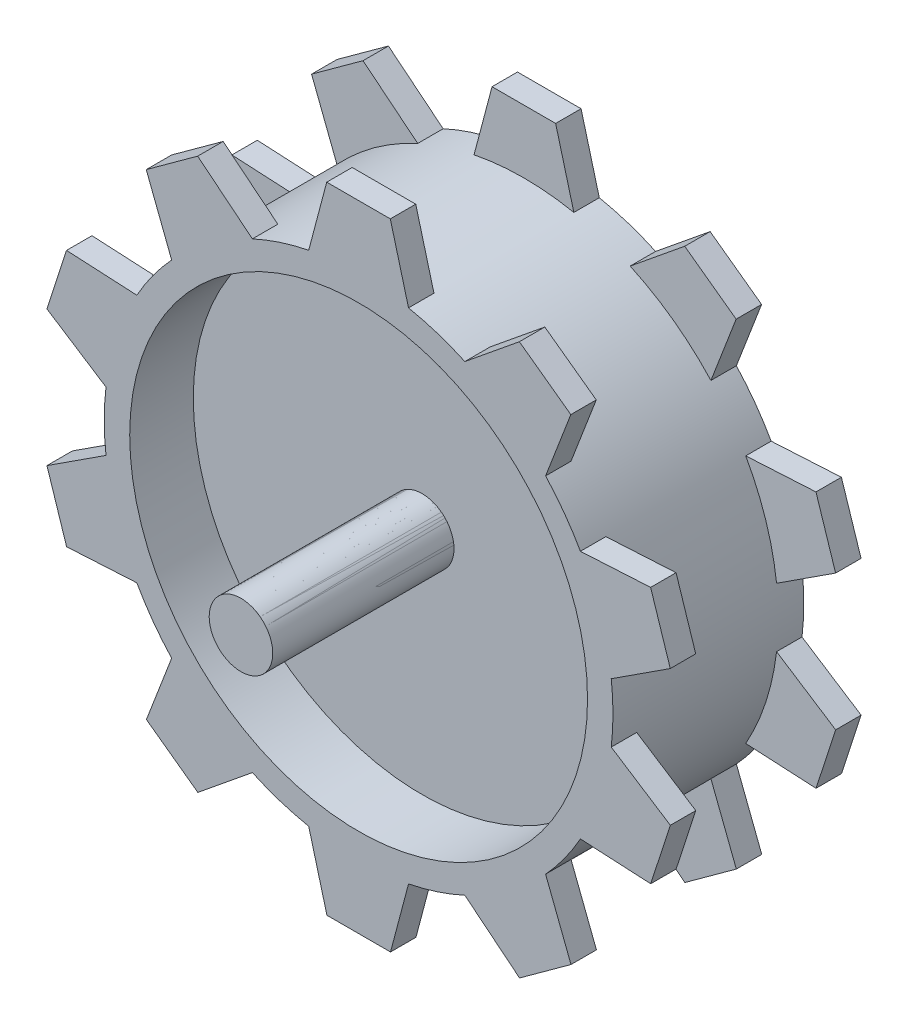
from build123d import *

# Parameters (mm, degrees)
SKETCH2_R                = 200
BOSS_EXTRUDE1_DEPTH      = 150
BOSS_EXTRUDE2_START      = -20
BOSS_EXTRUDE2_DEPTH      = 20
CIRPATTERN1_COUNT        = 10
MIRROR1_START            = -20
MIRROR1_COPY_1_DEPTH     = 20
MIRROR1_COPY_2_DEPTH     = 20
MIRROR1_COPY_3_DEPTH     = 20
MIRROR1_COPY_4_DEPTH     = 20
MIRROR1_COPY_5_DEPTH     = 20
MIRROR1_COPY_6_DEPTH     = 20
MIRROR1_COPY_7_DEPTH     = 20
MIRROR1_COPY_8_DEPTH     = 20
MIRROR1_COPY_9_DEPTH     = 20
MIRROR1_COPY_10_DEPTH    = 20
SKETCH4_R                = 25
CUT_EXTRUDE1_DEPTH       = 381.615674099
SKETCH6_R                = 180
CUT_EXTRUDE2_DEPTH       = 50
BOSS_EXTRUDE4_DEPTH      = 1
BOSS_EXTRUDE4_DEPTH_BACK = 192.5
SKETCH7_2_R              = 25
SKETCH7_R                = 25
BOSS_EXTRUDE3_DEPTH      = 192.5


with BuildPart() as part:
    # Sketch2 → Boss-Extrude1 (new body)
    with BuildSketch(Plane.XY):
        Circle(SKETCH2_R)
    extrude(amount=BOSS_EXTRUDE1_DEPTH)

    # Sketch3 → Boss-Extrude2 (add)
    with BuildSketch(Plane.XY.offset(150).offset(BOSS_EXTRUDE2_START)):
        with BuildLine():
            Line((-25.084847023, 249.575960236), (24.915152977, 249.575960236))
            Line((24.915152977, 249.575960236), (39.240601235, 196.112659496))
            ThreePointArc((39.240601235, 196.112659496), (0, 200), (-39.240601235, 196.112659496))
            Line((-39.240601235, 196.112659496), (-25.084847023, 249.575960236))
        make_face()
    boss_extrude2 = extrude(amount=BOSS_EXTRUDE2_DEPTH)

    # CirPattern1: Boss-Extrude2 ×10 about axis
    cirpattern1_axis = Axis((0, 0, 150), (0, 0, 1))
    for i in range(1, CIRPATTERN1_COUNT):
        add(boss_extrude2.rotate(cirpattern1_axis, i * 360 / CIRPATTERN1_COUNT))

    # Mirror1 copy 1 sketch → Mirror1 copy 1 (add)
    with BuildSketch(Plane(origin=(0, 0, 0), x_dir=(0.8090169943749475, 0.5877852522924731, 0), z_dir=(0, 0, -1)).offset(MIRROR1_START)):
        with BuildLine():
            Line((-25.084847023, -249.575960236), (24.915152977, -249.575960236))
            Line((24.915152977, -249.575960236), (39.240601235, -196.112659496))
            ThreePointArc((39.240601235, -196.112659496), (0, -200), (-39.240601235, -196.112659496))
            Line((-39.240601235, -196.112659496), (-25.084847023, -249.575960236))
        make_face()
    extrude(amount=MIRROR1_COPY_1_DEPTH)

    # Mirror1 copy 2 sketch → Mirror1 copy 2 (add)
    with BuildSketch(Plane(origin=(0, 0, 0), x_dir=(0.30901699437494745, 0.9510565162951535, 0), z_dir=(0, 0, -1)).offset(MIRROR1_START)):
        with BuildLine():
            Line((-25.084847023, -249.575960236), (24.915152977, -249.575960236))
            Line((24.915152977, -249.575960236), (39.240601235, -196.112659496))
            ThreePointArc((39.240601235, -196.112659496), (0, -200), (-39.240601235, -196.112659496))
            Line((-39.240601235, -196.112659496), (-25.084847023, -249.575960236))
        make_face()
    extrude(amount=MIRROR1_COPY_2_DEPTH)

    # Mirror1 copy 3 sketch → Mirror1 copy 3 (add)
    with BuildSketch(Plane(origin=(0, 0, 0), x_dir=(-0.30901699437494734, 0.9510565162951536, 0), z_dir=(0, 0, -1)).offset(MIRROR1_START)):
        with BuildLine():
            Line((-25.084847023, -249.575960236), (24.915152977, -249.575960236))
            Line((24.915152977, -249.575960236), (39.240601235, -196.112659496))
            ThreePointArc((39.240601235, -196.112659496), (0, -200), (-39.240601235, -196.112659496))
            Line((-39.240601235, -196.112659496), (-25.084847023, -249.575960236))
        make_face()
    extrude(amount=MIRROR1_COPY_3_DEPTH)

    # Mirror1 copy 4 sketch → Mirror1 copy 4 (add)
    with BuildSketch(Plane(origin=(0, 0, 0), x_dir=(-0.8090169943749473, 0.5877852522924732, 0), z_dir=(0, 0, -1)).offset(MIRROR1_START)):
        with BuildLine():
            Line((-25.084847023, -249.575960236), (24.915152977, -249.575960236))
            Line((24.915152977, -249.575960236), (39.240601235, -196.112659496))
            ThreePointArc((39.240601235, -196.112659496), (0, -200), (-39.240601235, -196.112659496))
            Line((-39.240601235, -196.112659496), (-25.084847023, -249.575960236))
        make_face()
    extrude(amount=MIRROR1_COPY_4_DEPTH)

    # Mirror1 copy 5 sketch → Mirror1 copy 5 (add)
    with BuildSketch(Plane(origin=(0, 0, 0), x_dir=(-1, 0, 0), z_dir=(0, 0, -1)).offset(MIRROR1_START)):
        with BuildLine():
            Line((-25.084847023, -249.575960236), (24.915152977, -249.575960236))
            Line((24.915152977, -249.575960236), (39.240601235, -196.112659496))
            ThreePointArc((39.240601235, -196.112659496), (0, -200), (-39.240601235, -196.112659496))
            Line((-39.240601235, -196.112659496), (-25.084847023, -249.575960236))
        make_face()
    extrude(amount=MIRROR1_COPY_5_DEPTH)

    # Mirror1 copy 6 sketch → Mirror1 copy 6 (add)
    with BuildSketch(Plane(origin=(0, 0, 0), x_dir=(-0.8090169943749476, -0.587785252292473, 0), z_dir=(0, 0, -1)).offset(MIRROR1_START)):
        with BuildLine():
            Line((-25.084847023, -249.575960236), (24.915152977, -249.575960236))
            Line((24.915152977, -249.575960236), (39.240601235, -196.112659496))
            ThreePointArc((39.240601235, -196.112659496), (0, -200), (-39.240601235, -196.112659496))
            Line((-39.240601235, -196.112659496), (-25.084847023, -249.575960236))
        make_face()
    extrude(amount=MIRROR1_COPY_6_DEPTH)

    # Mirror1 copy 7 sketch → Mirror1 copy 7 (add)
    with BuildSketch(Plane(origin=(0, 0, 0), x_dir=(-0.30901699437494756, -0.9510565162951535, 0), z_dir=(0, 0, -1)).offset(MIRROR1_START)):
        with BuildLine():
            Line((-25.084847023, -249.575960236), (24.915152977, -249.575960236))
            Line((24.915152977, -249.575960236), (39.240601235, -196.112659496))
            ThreePointArc((39.240601235, -196.112659496), (0, -200), (-39.240601235, -196.112659496))
            Line((-39.240601235, -196.112659496), (-25.084847023, -249.575960236))
        make_face()
    extrude(amount=MIRROR1_COPY_7_DEPTH)

    # Mirror1 copy 8 sketch → Mirror1 copy 8 (add)
    with BuildSketch(Plane(origin=(0, 0, 0), x_dir=(0.30901699437494723, -0.9510565162951536, 0), z_dir=(0, 0, -1)).offset(MIRROR1_START)):
        with BuildLine():
            Line((-25.084847023, -249.575960236), (24.915152977, -249.575960236))
            Line((24.915152977, -249.575960236), (39.240601235, -196.112659496))
            ThreePointArc((39.240601235, -196.112659496), (0, -200), (-39.240601235, -196.112659496))
            Line((-39.240601235, -196.112659496), (-25.084847023, -249.575960236))
        make_face()
    extrude(amount=MIRROR1_COPY_8_DEPTH)

    # Mirror1 copy 9 sketch → Mirror1 copy 9 (add)
    with BuildSketch(Plane(origin=(0, 0, 0), x_dir=(0.8090169943749473, -0.5877852522924734, 0), z_dir=(0, 0, -1)).offset(MIRROR1_START)):
        with BuildLine():
            Line((-25.084847023, -249.575960236), (24.915152977, -249.575960236))
            Line((24.915152977, -249.575960236), (39.240601235, -196.112659496))
            ThreePointArc((39.240601235, -196.112659496), (0, -200), (-39.240601235, -196.112659496))
            Line((-39.240601235, -196.112659496), (-25.084847023, -249.575960236))
        make_face()
    extrude(amount=MIRROR1_COPY_9_DEPTH)

    # Mirror1 copy 10 sketch → Mirror1 copy 10 (add)
    with BuildSketch(Plane(origin=(0, 0, 0), x_dir=(1, 0, 0), z_dir=(0, 0, -1)).offset(MIRROR1_START)):
        with BuildLine():
            Line((-25.084847023, -249.575960236), (24.915152977, -249.575960236))
            Line((24.915152977, -249.575960236), (39.240601235, -196.112659496))
            ThreePointArc((39.240601235, -196.112659496), (0, -200), (-39.240601235, -196.112659496))
            Line((-39.240601235, -196.112659496), (-25.084847023, -249.575960236))
        make_face()
    extrude(amount=MIRROR1_COPY_10_DEPTH)

    # Sketch4 → Cut-Extrude1 (cut, through all)
    with BuildSketch(Plane(origin=(0, 0, 0), x_dir=(-1, 0, 0), z_dir=(0, 0, -1))):
        Circle(SKETCH4_R)
    extrude(amount=-CUT_EXTRUDE1_DEPTH, mode=Mode.SUBTRACT)

    # Sketch6 → Cut-Extrude2 (cut)
    with BuildSketch(Plane.XY.offset(150)):
        Circle(SKETCH6_R)
    cut_extrude2 = extrude(amount=-CUT_EXTRUDE2_DEPTH, mode=Mode.SUBTRACT)

    # Mirror2: Cut-Extrude2 across plane
    add(cut_extrude2.mirror(Plane.XY.offset(75)), mode=Mode.SUBTRACT)


with BuildPart() as body_2:
    # Sketch7<2> → Boss-Extrude4 (new, two sides: drawn at the far end of the back side and taken through both)
    with BuildSketch(Plane(origin=(0, 0, 50), x_dir=(-1, 0, 0), z_dir=(0, 0, -1)).offset(-BOSS_EXTRUDE4_DEPTH_BACK)):
        Circle(SKETCH7_2_R)
    extrude(amount=BOSS_EXTRUDE4_DEPTH + BOSS_EXTRUDE4_DEPTH_BACK)


with BuildPart() as body_3:
    # Sketch7 → Boss-Extrude3 (new body)
    with BuildSketch(Plane(origin=(0, 0, 50), x_dir=(-1, 0, 0), z_dir=(0, 0, -1))):
        Circle(SKETCH7_R)
    extrude(amount=-BOSS_EXTRUDE3_DEPTH)


solid = Compound([part.part, body_2.part, body_3.part])
